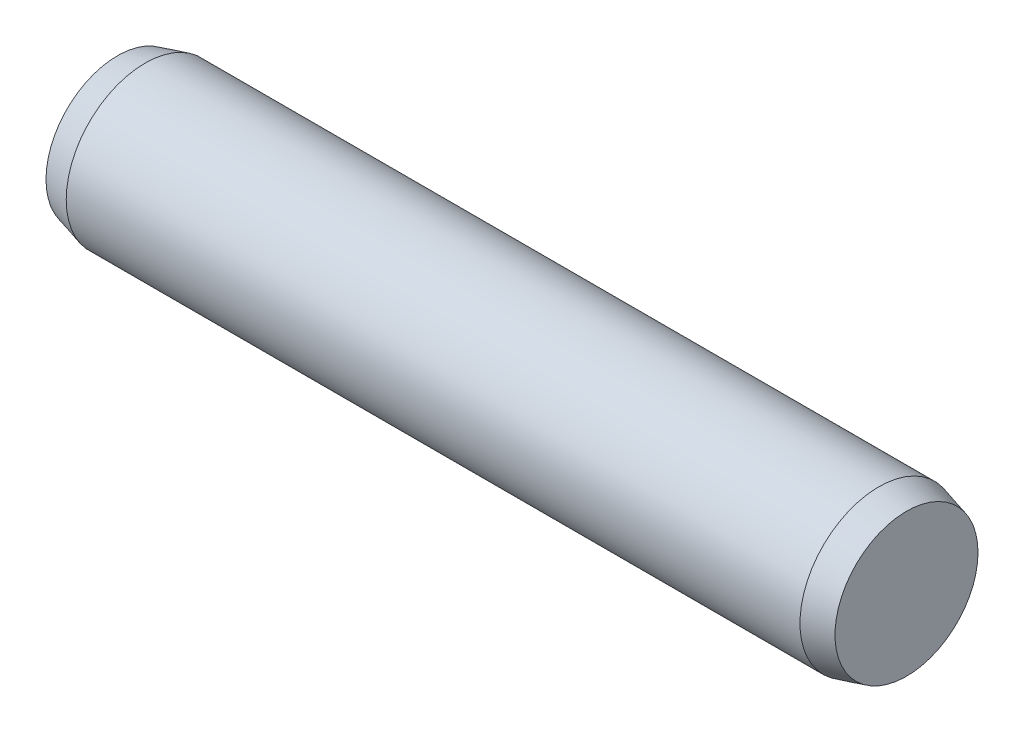
from build123d import *

# Parameters (mm, degrees)
EXTRUDE1_DEPTH      = 4.65
EXTRUDE1_DEPTH_BACK = 4.65
SKETCH2_R           = 1
SKETCH3_R           = 1
EXTRUDE2_DEPTH      = 0.35
EXTRUDE2_TAPER      = 15
SKETCH4_R           = 1
EXTRUDE3_DEPTH      = 0.35
EXTRUDE3_TAPER      = 15


with BuildPart() as part:
    # Sketch2 → Extrude1 (new, two sides: drawn at the far end of the back side and taken through both)
    with BuildSketch(Plane(origin=(0, 0, 0), x_dir=(0, 0, -1), z_dir=(1, 0, 0)).offset(-EXTRUDE1_DEPTH_BACK)):
        Circle(SKETCH2_R)
    extrude(amount=EXTRUDE1_DEPTH + EXTRUDE1_DEPTH_BACK)

    # Sketch3 → Extrude2 (add)
    with BuildSketch(Plane(origin=(4.65, 0, 0), x_dir=(0, 0, -1), z_dir=(1, 0, 0))):
        Circle(SKETCH3_R)
    extrude(amount=EXTRUDE2_DEPTH, taper=EXTRUDE2_TAPER)

    # Sketch4 → Extrude3 (add)
    with BuildSketch(Plane.ZY.offset(4.65)):
        with Locations(Location((0, 0, 0), (0, 0, 180))):
            Circle(SKETCH4_R)
    extrude(amount=EXTRUDE3_DEPTH, taper=EXTRUDE3_TAPER)


solid = part.part
